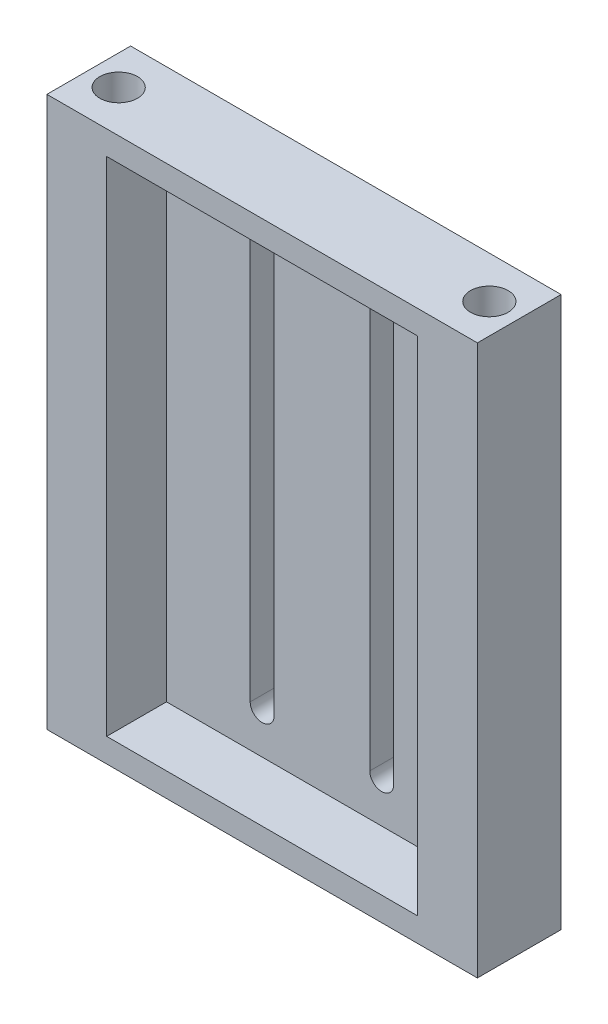
from build123d import *

# Parameters (mm, degrees)
SKETCH1_W           = 36
SKETCH1_H           = 46
BOSS_EXTRUDE1_DEPTH = 2
SKETCH2_W           = 36
SKETCH2_H           = 46
SKETCH2_W_2         = 26
SKETCH2_H_2         = 42
BOSS_EXTRUDE2_DEPTH = 5
SKETCH3_R           = 1.575
CUT_EXTRUDE1_DEPTH  = 50.889878733
CUT_EXTRUDE2_DEPTH  = 2


with BuildPart() as part:
    # Sketch1 → Boss-Extrude1 (new body)
    with BuildSketch(Plane.XY):
        Rectangle(SKETCH1_W, SKETCH1_H)
    extrude(amount=BOSS_EXTRUDE1_DEPTH)

    # Sketch2 → Boss-Extrude2 (add)
    with BuildSketch(Plane.XY.offset(2)):
        Rectangle(SKETCH2_W, SKETCH2_H)
        Rectangle(SKETCH2_W_2, SKETCH2_H_2, mode=Mode.SUBTRACT)
    extrude(amount=BOSS_EXTRUDE2_DEPTH)

    # Sketch3 → Cut-Extrude1 (cut, through all)
    with BuildSketch(Plane(origin=(0, 23, 0), x_dir=(1, 0, 0), z_dir=(0, 1, 0))):
        with Locations(Location((-15.5, -3.5, 0), (0, 0, 270))):
            Circle(SKETCH3_R)
        with Locations(Location((15.5, -3.5, 0), (0, 0, 90))):
            Circle(SKETCH3_R)
    extrude(amount=-CUT_EXTRUDE1_DEPTH, mode=Mode.SUBTRACT)

    # Sketch4 → Cut-Extrude2 (cut)
    with BuildSketch(Plane(origin=(0, 0, 0), x_dir=(-1, 0, 0), z_dir=(0, 0, -1))):
        with BuildLine():
            Line((-4, 17.5), (-4, -17.5))
            ThreePointArc((-4, -17.5), (-5, -18.5), (-6, -17.5))
            Line((-6, -17.5), (-6, 17.5))
            ThreePointArc((-6, 17.5), (-5, 18.5), (-4, 17.5))
        make_face()
        with BuildLine():
            Line((4, 17.5), (4, -17.5))
            ThreePointArc((4, -17.5), (5, -18.5), (6, -17.5))
            Line((6, -17.5), (6, 17.5))
            ThreePointArc((6, 17.5), (5, 18.5), (4, 17.5))
        make_face()
    extrude(amount=-CUT_EXTRUDE2_DEPTH, mode=Mode.SUBTRACT)


solid = part.part
